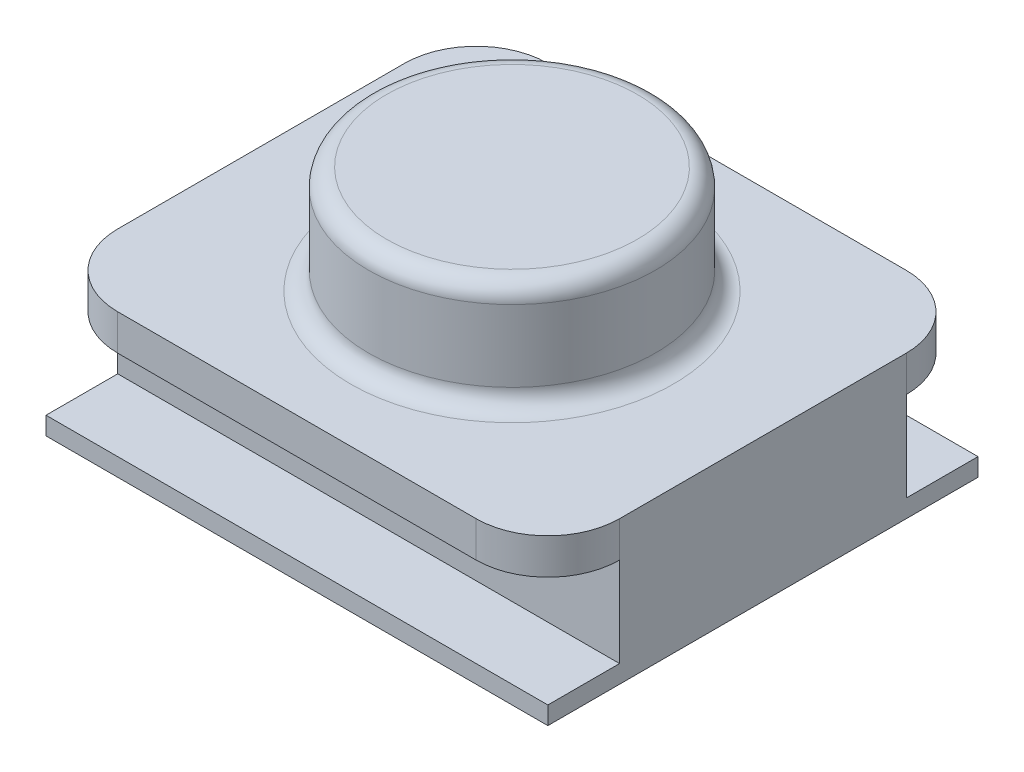
from build123d import *

# Parameters (mm, degrees)
SZKIC1_W                    = 7
SZKIC1_H                    = 6
DODANIE_WYCI_GNI_CIE1_DEPTH = 0.25
SZKIC2_W                    = 7
SZKIC2_H                    = 4
DODANIE_WYCI_GNI_CIE2_DEPTH = 1.25
SZKIC3_W                    = 7
SZKIC3_H                    = 6
DODANIE_WYCI_GNI_CIE3_DEPTH = 0.5
SZKIC4_R                    = 2
DODANIE_WYCI_GNI_CIE4_DEPTH = 1.5
ZAOKR_GLENIE1_R             = 0.25
ZAOKR_GLENIE2_R             = 1
SZKIC5_W                    = 4
SZKIC5_H                    = 1
DODANIE_WYCI_GNI_CIE5_DEPTH = 1
SZKIC6_W                    = 2
SZKIC6_H                    = 0.25
WYTNIJ_WYCI_GNI_CIE1_DEPTH  = 1


with BuildPart() as part:
    # Szkic1 → Dodanie-wyciągnięcie1 (new body)
    with BuildSketch(Plane(origin=(0, 0, 0), x_dir=(1, 0, 0), z_dir=(0, 1, 0))):
        Rectangle(SZKIC1_W, SZKIC1_H)
    extrude(amount=DODANIE_WYCI_GNI_CIE1_DEPTH)

    # Szkic2 → Dodanie-wyciągnięcie2 (add)
    with BuildSketch(Plane(origin=(0, 0.25, 0), x_dir=(1, 0, 0), z_dir=(0, 1, 0))):
        Rectangle(SZKIC2_W, SZKIC2_H)
    extrude(amount=DODANIE_WYCI_GNI_CIE2_DEPTH)

    # Szkic3 → Dodanie-wyciągnięcie3 (add)
    with BuildSketch(Plane(origin=(0, 1.5, 0), x_dir=(1, 0, 0), z_dir=(0, 1, 0))):
        Rectangle(SZKIC3_W, SZKIC3_H)
    extrude(amount=DODANIE_WYCI_GNI_CIE3_DEPTH)

    # Szkic4 → Dodanie-wyciągnięcie4 (add)
    with BuildSketch(Plane(origin=(0, 2, 0), x_dir=(1, 0, 0), z_dir=(0, 1, 0))):
        with Locations(Location((0, 0, 0), (0, 0, 270))):
            Circle(SZKIC4_R)
    extrude(amount=DODANIE_WYCI_GNI_CIE4_DEPTH)

    # Zaokrąglenie1
    zaokr_glenie1_edges = [part.edges().sort_by_distance(p)[0] for p in [
        (0, 2, -2),
        (0, 3.5, -2),
    ]]
    fillet(zaokr_glenie1_edges, radius=ZAOKR_GLENIE1_R)

    # Zaokrąglenie2
    zaokr_glenie2_edges = [part.edges().sort_by_distance(p)[0] for p in [
        (-3.5, 1.75, -3),
        (3.5, 1.75, -3),
        (3.5, 1.75, 3),
        (-3.5, 1.75, 3),
    ]]
    fillet(zaokr_glenie2_edges, radius=ZAOKR_GLENIE2_R)

    # Szkic5 → Dodanie-wyciągnięcie5 (add)
    with BuildSketch(Plane.XZ):
        Rectangle(SZKIC5_W, SZKIC5_H)
    extrude(amount=DODANIE_WYCI_GNI_CIE5_DEPTH)

    # Szkic6 → Wytnij-wyciągnięcie1 (cut)
    with BuildSketch(Plane(origin=(0, 0, -0.5), x_dir=(-1, 0, 0), z_dir=(0, 0, -1))):
        with Locations((0, -0.375)):
            Rectangle(SZKIC6_W, SZKIC6_H)
    extrude(amount=-WYTNIJ_WYCI_GNI_CIE1_DEPTH, mode=Mode.SUBTRACT)


solid = part.part
